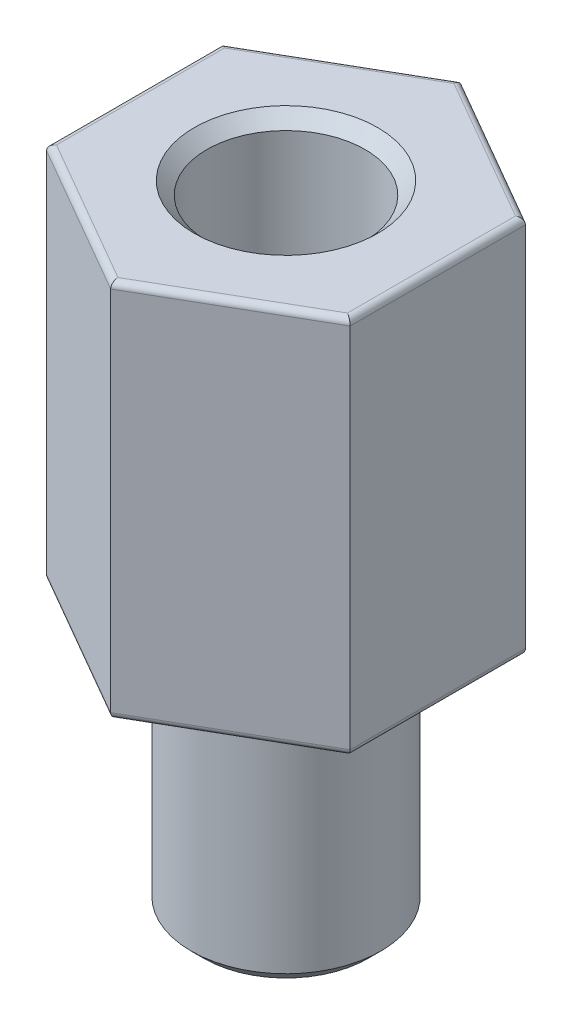
from build123d import *

# Parameters (mm, degrees)
SKETCH_2_R            = 1.5
EXTRUDE_1_DEPTH       = 4
EXTRUDE_2_DEPTH       = 6
FILLET_1_R            = 0.1
HOLE_WIZARD_M31_D     = 2.5
HOLE_WIZARD_M31_DEPTH = 5
HOLE_WIZARD_M31_TIP   = 0.751075774
CHAMFER_2_SIZE        = 0.2


with BuildPart() as part:
    # Эскиз2 → Бобышка-Вытянуть1 (new body)
    with BuildSketch(Plane(origin=(0, 0, 0), x_dir=(1, 0, 0), z_dir=(0, 1, 0))):
        with Locations(Location((0, 0, 0), (0, 0, 270))):
            Circle(SKETCH_2_R)
    extrude(amount=EXTRUDE_1_DEPTH)

    # Эскиз3 → Бобышка-Вытянуть2 (add)
    with BuildSketch(Plane(origin=(0, 4, 0), x_dir=(1, 0, 0), z_dir=(0, 1, 0))):
        Polygon((-2.4, 1.385640646), (-2.4, -1.385640646), (0, -2.771281292), (2.4, -1.385640646), (2.4, 1.385640646), (0, 2.771281292), align=None)
    extrude(amount=EXTRUDE_2_DEPTH)

    # Скругление1
    fillet_1_edges = [part.edges().sort_by_distance(p)[0] for p in [
        (-1.2, 4, -2.078460969),
        (-2.4, 4, 0),
        (-1.2, 4, 2.078460969),
        (1.2, 4, 2.078460969),
        (2.4, 4, 0),
        (1.2, 4, -2.078460969),
        (-1.2, 10, -2.078460969),
        (-2.4, 10, 0),
        (-1.2, 10, 2.078460969),
        (1.2, 10, 2.078460969),
        (2.4, 10, 0),
        (1.2, 10, -2.078460969),
    ]]
    fillet(fillet_1_edges, radius=FILLET_1_R)

    # Отверстие обработанное метчиком M31
    with Locations(Plane.ZX.offset(10)):
        with Locations((0, 0)):
            Hole(HOLE_WIZARD_M31_D / 2, depth=HOLE_WIZARD_M31_DEPTH)
            with Locations((0, 0, -(HOLE_WIZARD_M31_DEPTH + HOLE_WIZARD_M31_TIP / 2))):  # 118° drill point
                Cone(0, HOLE_WIZARD_M31_D / 2, HOLE_WIZARD_M31_TIP, mode=Mode.SUBTRACT)

    # Фаска2
    chamfer_2_edges = [part.edges().sort_by_distance(p)[0] for p in [
        (0, 0, -1.5),
        (0, 10, 1.25),
    ]]
    chamfer(chamfer_2_edges, length=CHAMFER_2_SIZE)


solid = part.part
